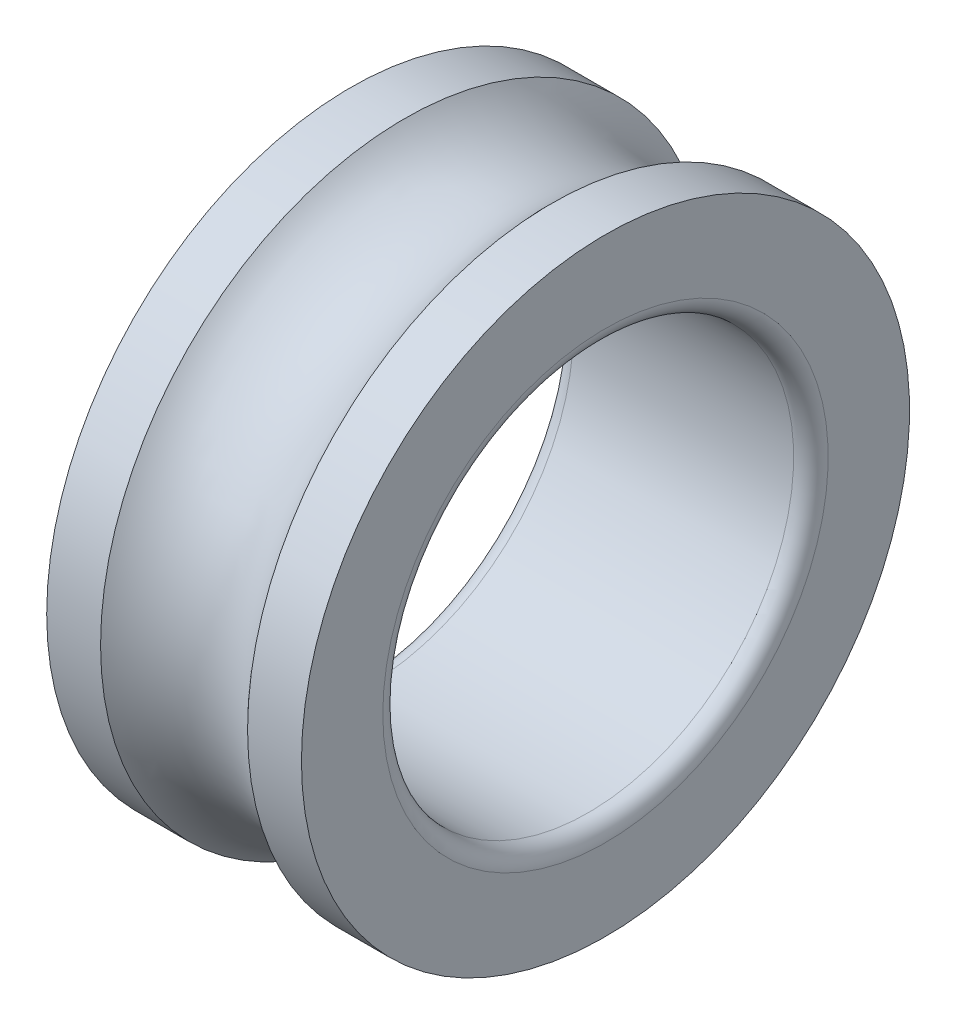
from build123d import *

# Parameters (mm, degrees)
FILLET1_R = 2.1


with BuildPart() as part:
    # Sketch1 → Revolve1 (revolve)
    with BuildSketch(Plane.XY, mode=Mode.PRIVATE) as revolve1_sk:
        with BuildLine():
            Line((-15.5, 37), (-8.94427191, 37))
            ThreePointArc((-8.94427191, 37), (0, 33), (8.94427191, 37))
            Line((8.94427191, 37), (15.5, 37))
            Line((15.5, 37), (15.5, 25))
            Line((15.5, 25), (-15.5, 25))
            Line((-15.5, 25), (-15.5, 37))
        make_face()
    revolve(revolve1_sk.sketch.rotate(Axis((0, 0, 0), (1, 0, 0)), 90), axis=Axis((0, 0, 0), (1, 0, 0)))

    # Fillet1
    fillet1_edges = [part.edges().sort_by_distance(p)[0] for p in [
        (15.5, 0, -25),
        (-15.5, 0, -25),
    ]]
    fillet(fillet1_edges, radius=FILLET1_R)


solid = part.part
